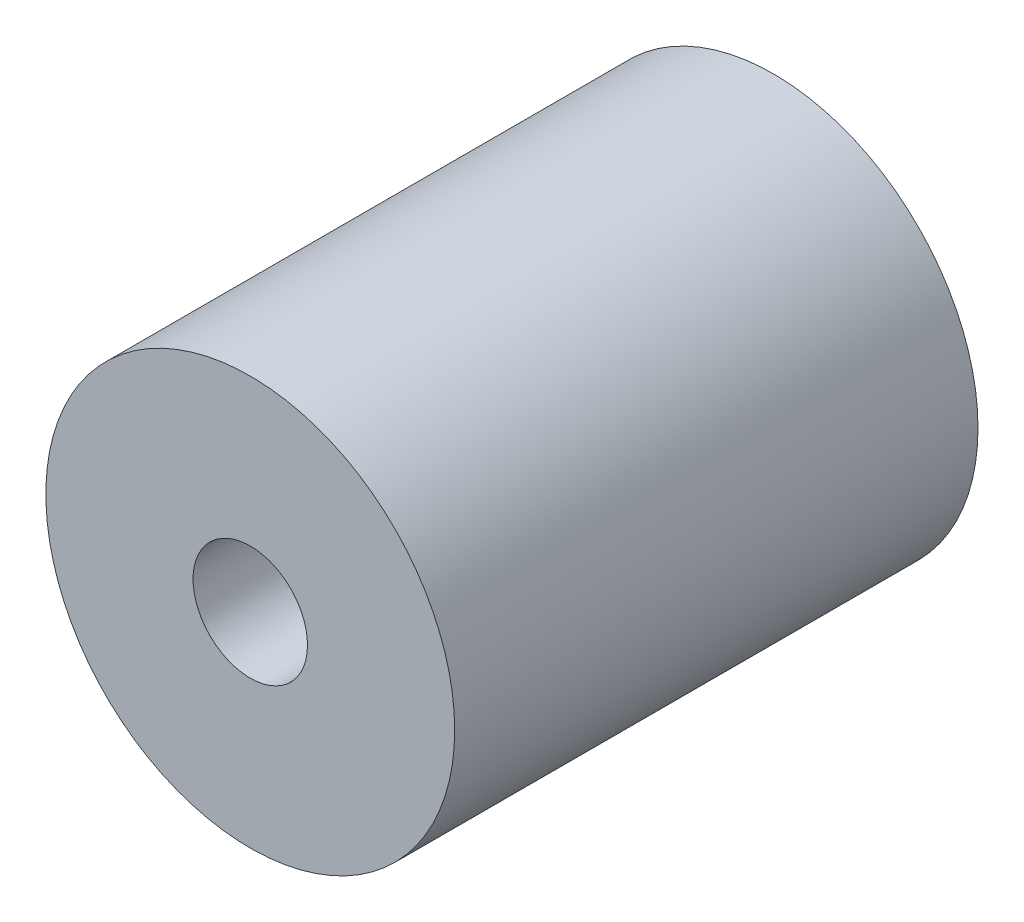
from build123d import *

# Parameters (mm, degrees)
SKETCH1_R           = 12.5
SKETCH1_R_2         = 3.5
BOSS_EXTRUDE1_DEPTH = 16


with BuildPart() as part:
    # Sketch1 → Boss-Extrude1 (new, symmetric)
    with BuildSketch(Plane.XY):
        Circle(SKETCH1_R)
        Circle(SKETCH1_R_2, mode=Mode.SUBTRACT)
    extrude(amount=BOSS_EXTRUDE1_DEPTH, both=True)


solid = part.part
